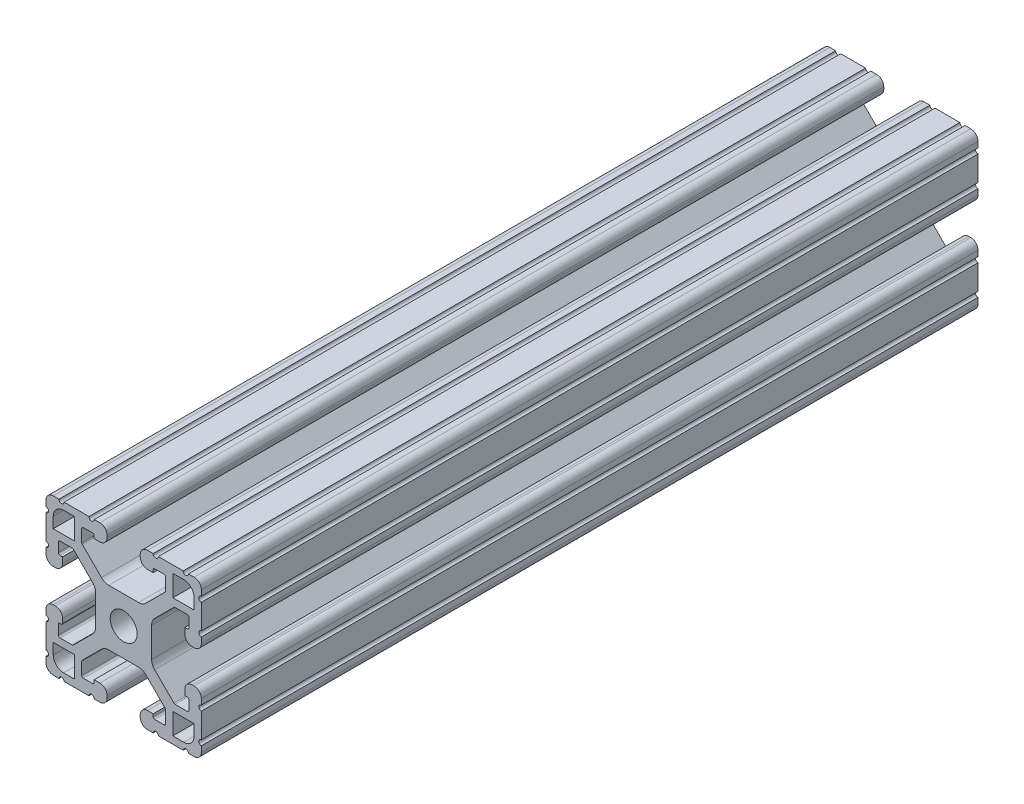
from build123d import *

# Parameters (mm, degrees)
BOSS_EXTRUDE1_DEPTH      = 95.25
BOSS_EXTRUDE1_DEPTH_BACK = 95.25
SKETCH3_W                = 38.1
SKETCH3_H                = 38.1
SKETCH4_W                = 5.207
SKETCH4_H                = 5.207
SKETCH4_R                = 3.302
CUT_EXTRUDE1_DEPTH       = 193.395569076
CUT_EXTRUDE2_DEPTH       = 193.395569076
FILLET1_R                = 2.54
FILLET2_R                = 1.778
FILLET3_R                = 0.396875


with BuildPart() as part:
    # Sketch3 → Boss-Extrude1 (new, two sides: drawn at the far end of the back side and taken through both)
    with BuildSketch(Plane.XY.offset(-BOSS_EXTRUDE1_DEPTH_BACK)):
        Rectangle(SKETCH3_W, SKETCH3_H)
    extrude(amount=BOSS_EXTRUDE1_DEPTH + BOSS_EXTRUDE1_DEPTH_BACK)

    # Sketch4 → Cut-Extrude1 (cut, through all)
    with BuildSketch(Plane.XY.offset(95.25)):
        Polygon((7.239, 14.986), (4.064, 14.986), (4.064, 19.05), (-4.064, 19.05), (-4.064, 14.986), (-7.239, 14.986), (-7.239, 16.002), (-10.287, 16.002), (-10.287, 12.442261469), (-4.702738531, 6.858), (4.702738531, 6.858), (10.287, 12.442261469), (10.287, 16.002), (7.239, 16.002), align=None)
        Polygon((10.287, -12.442261469), (4.702738531, -6.858), (-4.702738531, -6.858), (-10.287, -12.442261469), (-10.287, -16.002), (-7.239, -16.002), (-7.239, -14.986), (-4.064, -14.986), (-4.064, -19.05), (4.064, -19.05), (4.064, -14.986), (7.239, -14.986), (7.239, -16.002), (10.287, -16.002), align=None)
        Polygon((-12.442261469, -10.287), (-6.858, -4.702738531), (-6.858, 4.702738531), (-12.442261469, 10.287), (-16.002, 10.287), (-16.002, 7.239), (-14.986, 7.239), (-14.986, 4.064), (-19.05, 4.064), (-19.05, -4.064), (-14.986, -4.064), (-14.986, -7.239), (-16.002, -7.239), (-16.002, -10.287), align=None)
        Polygon((14.986, -7.239), (14.986, -4.064), (19.05, -4.064), (19.05, 4.064), (14.986, 4.064), (14.986, 7.239), (16.002, 7.239), (16.002, 10.287), (12.442261469, 10.287), (6.858, 4.702738531), (6.858, -4.702738531), (12.442261469, -10.287), (16.002, -10.287), (16.002, -7.239), align=None)
        with Locations((14.6685, 14.6685)):
            Rectangle(SKETCH4_W, SKETCH4_H)
        with Locations((14.6685, -14.6685)):
            Rectangle(SKETCH4_W, SKETCH4_H)
        with Locations((-14.6685, 14.6685)):
            Rectangle(SKETCH4_W, SKETCH4_H)
        with Locations((-14.6685, -14.6685)):
            Rectangle(SKETCH4_W, SKETCH4_H)
        Circle(SKETCH4_R)
    extrude(amount=-CUT_EXTRUDE1_DEPTH, mode=Mode.SUBTRACT)

    # Sketch5 → Cut-Extrude2 (cut, through all)
    with BuildSketch(Plane.XY.offset(95.25)):
        with BuildLine():
            Line((-14.605, 19.05), (-15.875, 19.05))
            ThreePointArc((-15.875, 19.05), (-15.24, 18.415), (-14.605, 19.05))
        make_face()
        with BuildLine():
            Line((-7.239, 19.05), (-8.509, 19.05))
            ThreePointArc((-8.509, 19.05), (-7.874, 18.415), (-7.239, 19.05))
        make_face()
        with BuildLine():
            ThreePointArc((-19.05, 14.605), (-18.415, 15.24), (-19.05, 15.875))
            Line((-19.05, 15.875), (-19.05, 14.605))
        make_face()
        with BuildLine():
            ThreePointArc((-19.05, 7.239), (-18.415, 7.874), (-19.05, 8.509))
            Line((-19.05, 8.509), (-19.05, 7.239))
        make_face()
        with BuildLine():
            ThreePointArc((7.239, 19.05), (7.874, 18.415), (8.509, 19.05))
            Line((8.509, 19.05), (7.239, 19.05))
        make_face()
        with BuildLine():
            ThreePointArc((14.605, 19.05), (15.24, 18.415), (15.875, 19.05))
            Line((15.875, 19.05), (14.605, 19.05))
        make_face()
        with BuildLine():
            Line((19.05, 14.605), (19.05, 15.875))
            ThreePointArc((19.05, 15.875), (18.415, 15.24), (19.05, 14.605))
        make_face()
        with BuildLine():
            Line((19.05, 7.239), (19.05, 8.509))
            ThreePointArc((19.05, 8.509), (18.415, 7.874), (19.05, 7.239))
        make_face()
        with BuildLine():
            ThreePointArc((19.05, -7.239), (18.415, -7.874), (19.05, -8.509))
            Line((19.05, -8.509), (19.05, -7.239))
        make_face()
        with BuildLine():
            ThreePointArc((19.05, -14.605), (18.415, -15.24), (19.05, -15.875))
            Line((19.05, -15.875), (19.05, -14.605))
        make_face()
        with BuildLine():
            Line((14.605, -19.05), (15.875, -19.05))
            ThreePointArc((15.875, -19.05), (15.24, -18.415), (14.605, -19.05))
        make_face()
        with BuildLine():
            Line((7.239, -19.05), (8.509, -19.05))
            ThreePointArc((8.509, -19.05), (7.874, -18.415), (7.239, -19.05))
        make_face()
        with BuildLine():
            ThreePointArc((-7.239, -19.05), (-7.874, -18.415), (-8.509, -19.05))
            Line((-8.509, -19.05), (-7.239, -19.05))
        make_face()
        with BuildLine():
            ThreePointArc((-14.605, -19.05), (-15.24, -18.415), (-15.875, -19.05))
            Line((-15.875, -19.05), (-14.605, -19.05))
        make_face()
        with BuildLine():
            Line((-19.05, -14.605), (-19.05, -15.875))
            ThreePointArc((-19.05, -15.875), (-18.415, -15.24), (-19.05, -14.605))
        make_face()
        with BuildLine():
            Line((-19.05, -7.239), (-19.05, -8.509))
            ThreePointArc((-19.05, -8.509), (-18.415, -7.874), (-19.05, -7.239))
        make_face()
    extrude(amount=-CUT_EXTRUDE2_DEPTH, mode=Mode.SUBTRACT)

    # Fillet1
    fillet1_edges = [part.edges().sort_by_distance(p)[0] for p in [
        (6.858, -4.702738531, 0),
        (6.858, 4.702738531, 0),
        (-17.272, 17.272, 0),
        (-17.272, -17.272, 0),
        (17.272, -17.272, 0),
        (17.272, 17.272, 0),
        (-4.702738531, -6.858, 0),
        (4.702738531, -6.858, 0),
        (-6.858, 4.702738531, 0),
        (-6.858, -4.702738531, 0),
        (4.702738531, 6.858, 0),
        (-4.702738531, 6.858, 0),
    ]]
    fillet(fillet1_edges, radius=FILLET1_R)

    # Fillet2
    fillet2_edges = [part.edges().sort_by_distance(p)[0] for p in [
        (14.986, 4.064, 0),
        (19.05, 4.064, 0),
        (19.05, -4.064, 0),
        (14.986, -4.064, 0),
        (4.064, -14.986, 0),
        (4.064, -19.05, 0),
        (-4.064, -19.05, 0),
        (-4.064, -14.986, 0),
        (-14.986, -4.064, 0),
        (-19.05, -4.064, 0),
        (-19.05, 4.064, 0),
        (-14.986, 4.064, 0),
        (-19.05, 19.05, 0),
        (19.05, 19.05, 0),
        (19.05, -19.05, 0),
        (-19.05, -19.05, 0),
        (-4.064, 14.986, 0),
        (-4.064, 19.05, 0),
        (4.064, 19.05, 0),
        (4.064, 14.986, 0),
    ]]
    fillet(fillet2_edges, radius=FILLET2_R)

    # Fillet3
    fillet3_edges = [part.edges().sort_by_distance(p)[0] for p in [
        (12.442261469, 10.287, 0),
        (16.002, 10.287, 0),
        (16.002, 7.239, 0),
        (16.002, -7.239, 0),
        (16.002, -10.287, 0),
        (12.442261469, -10.287, 0),
        (-7.239, -16.002, 0),
        (-10.287, -16.002, 0),
        (-10.287, -12.442261469, 0),
        (10.287, -12.442261469, 0),
        (10.287, -16.002, 0),
        (7.239, -16.002, 0),
        (-16.002, 7.239, 0),
        (-16.002, 10.287, 0),
        (-12.442261469, 10.287, 0),
        (-12.442261469, -10.287, 0),
        (-16.002, -10.287, 0),
        (-14.986, -7.239, 0),
        (-10.287, 12.442261469, 0),
        (-10.287, 16.002, 0),
        (-7.239, 16.002, 0),
        (7.239, 16.002, 0),
        (10.287, 16.002, 0),
        (10.287, 12.442261469, 0),
    ]]
    fillet(fillet3_edges, radius=FILLET3_R)


solid = part.part
